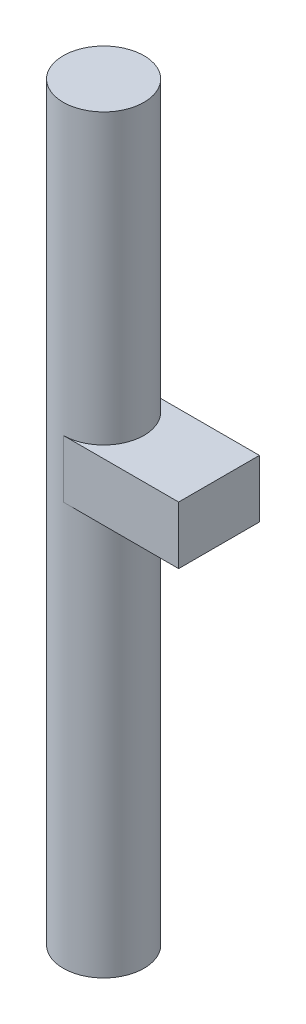
from build123d import *

# Parameters (mm, degrees)
SKETCH1_R           = 1.778
BOSS_EXTRUDE1_DEPTH = 33.02
SKETCH2_W           = 3.556
SKETCH2_H           = 2.54
BOSS_EXTRUDE2_DEPTH = 5.08


with BuildPart() as part:
    # Sketch1 → Boss-Extrude1 (new body)
    with BuildSketch(Plane(origin=(0, 0, 0), x_dir=(1, 0, 0), z_dir=(0, 1, 0))):
        Circle(SKETCH1_R)
    extrude(amount=BOSS_EXTRUDE1_DEPTH)

    # Sketch2 → Boss-Extrude2 (add)
    with BuildSketch(Plane(origin=(0, 0, 0), x_dir=(0, 0, -1), z_dir=(1, 0, 0))):
        with Locations((0, 19.05)):
            Rectangle(SKETCH2_W, SKETCH2_H)
    extrude(amount=BOSS_EXTRUDE2_DEPTH)


solid = part.part
